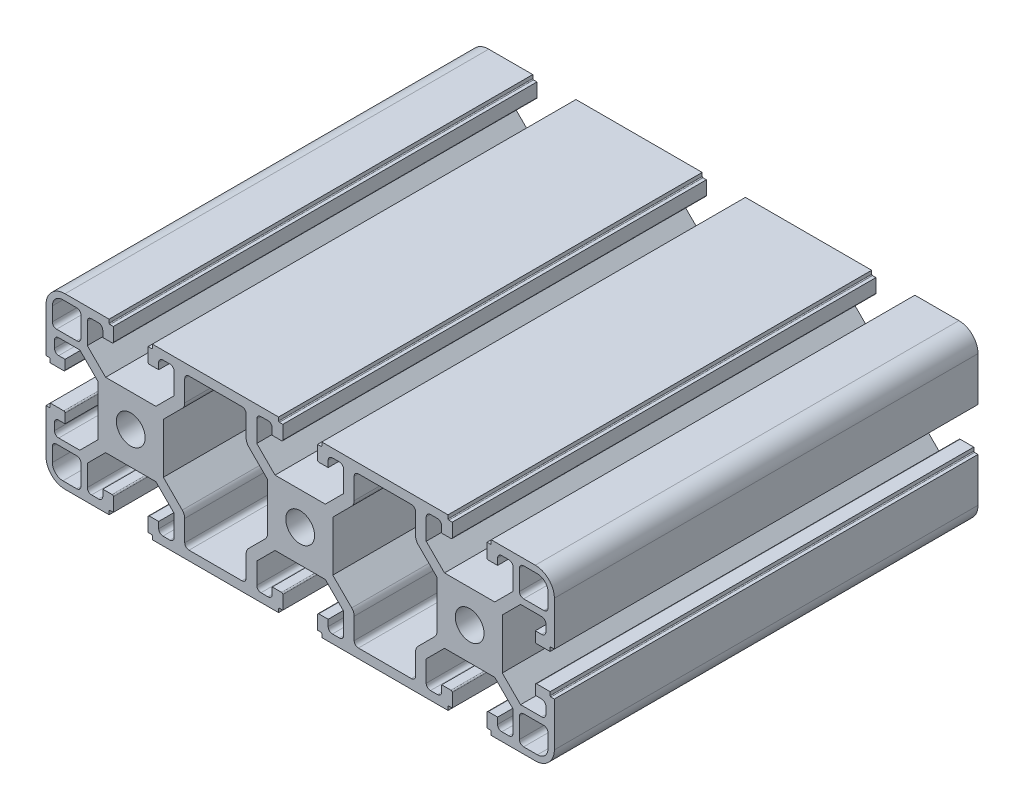
from build123d import *

# Parameters (mm, degrees)
SKETCH_1_R      = 3.4
EXTRUDE_1_DEPTH = 100


with BuildPart() as part:
    # 草图1 → 凸台-拉伸1 (new body)
    with BuildSketch(Plane.XY):
        with BuildLine():
            Line((-45.8856131, 20.757012623), (-56.2856131, 20.757012623))
            ThreePointArc((-56.2856131, 20.757012623), (-59.467593615, 19.438993138), (-60.7856131, 16.257012623))
            Line((-60.7856131, 16.257012623), (-60.7856131, 5.857012623))
            Line((-60.7856131, 5.857012623), (-59.9856131, 5.857012623))
            ThreePointArc((-59.9856131, 5.857012623), (-59.844191743, 5.798433979), (-59.7856131, 5.657012623))
            Line((-59.7856131, 5.657012623), (-59.7856131, 4.857012623))
            Line((-59.7856131, 4.857012623), (-56.5856131, 4.857012623))
            ThreePointArc((-56.5856131, 4.857012623), (-56.373481065, 4.944880588), (-56.2856131, 5.157012623))
            Line((-56.2856131, 5.157012623), (-56.2856131, 7.357012623))
            Line((-56.2856131, 7.357012623), (-57.7856131, 7.357012623))
            ThreePointArc((-57.7856131, 7.357012623), (-58.492719881, 7.649905842), (-58.7856131, 8.357012623))
            Line((-58.7856131, 8.357012623), (-58.7856131, 10.007012623))
            ThreePointArc((-58.7856131, 10.007012623), (-58.492719881, 10.714119404), (-57.7856131, 11.007012623))
            Line((-57.7856131, 11.007012623), (-52.803380053, 11.007012623))
            Line((-52.803380053, 11.007012623), (-48.4856131, 6.68924567))
            Line((-48.4856131, 6.68924567), (-48.4856131, -5.175220424))
            Line((-48.4856131, -5.175220424), (-52.803380053, -9.492987377))
            Line((-52.803380053, -9.492987377), (-57.7856131, -9.492987377))
            ThreePointArc((-57.7856131, -9.492987377), (-58.492719881, -9.200094158), (-58.7856131, -8.492987377))
            Line((-58.7856131, -8.492987377), (-58.7856131, -6.842987377))
            ThreePointArc((-58.7856131, -6.842987377), (-58.492719881, -6.135880596), (-57.7856131, -5.842987377))
            Line((-57.7856131, -5.842987377), (-56.2856131, -5.842987377))
            Line((-56.2856131, -5.842987377), (-56.2856131, -3.642987377))
            ThreePointArc((-56.2856131, -3.642987377), (-56.373481065, -3.430855343), (-56.5856131, -3.342987377))
            Line((-56.5856131, -3.342987377), (-59.7856131, -3.342987377))
            Line((-59.7856131, -3.342987377), (-59.7856131, -4.142987377))
            ThreePointArc((-59.7856131, -4.142987377), (-59.844191743, -4.284408734), (-59.9856131, -4.342987377))
            Line((-59.9856131, -4.342987377), (-60.7856131, -4.342987377))
            Line((-60.7856131, -4.342987377), (-60.7856131, -14.742987377))
            ThreePointArc((-60.7856131, -14.742987377), (-59.467593615, -17.924967893), (-56.2856131, -19.242987377))
            Line((-56.2856131, -19.242987377), (-45.8856131, -19.242987377))
            Line((-45.8856131, -19.242987377), (-45.8856131, -18.442987377))
            ThreePointArc((-45.8856131, -18.442987377), (-45.827034456, -18.301566021), (-45.6856131, -18.242987377))
            Line((-45.6856131, -18.242987377), (-44.8856131, -18.242987377))
            Line((-44.8856131, -18.242987377), (-44.8856131, -15.042987377))
            ThreePointArc((-44.8856131, -15.042987377), (-44.973481065, -14.830855343), (-45.1856131, -14.742987377))
            Line((-45.1856131, -14.742987377), (-47.3856131, -14.742987377))
            Line((-47.3856131, -14.742987377), (-47.3856131, -16.242987377))
            ThreePointArc((-47.3856131, -16.242987377), (-47.678506318, -16.950094158), (-48.3856131, -17.242987377))
            Line((-48.3856131, -17.242987377), (-50.0356131, -17.242987377))
            ThreePointArc((-50.0356131, -17.242987377), (-50.742719881, -16.950094158), (-51.0356131, -16.242987377))
            Line((-51.0356131, -16.242987377), (-51.0356131, -11.26075433))
            Line((-51.0356131, -11.26075433), (-46.717846147, -6.942987377))
            Line((-46.717846147, -6.942987377), (-34.853380053, -6.942987377))
            Line((-34.853380053, -6.942987377), (-30.5356131, -11.26075433))
            Line((-30.5356131, -11.26075433), (-30.5356131, -16.242987377))
            ThreePointArc((-30.5356131, -16.242987377), (-30.828506318, -16.950094158), (-31.5356131, -17.242987377))
            Line((-31.5356131, -17.242987377), (-33.1856131, -17.242987377))
            ThreePointArc((-33.1856131, -17.242987377), (-33.892719881, -16.950094158), (-34.1856131, -16.242987377))
            Line((-34.1856131, -16.242987377), (-34.1856131, -14.742987377))
            Line((-34.1856131, -14.742987377), (-36.3856131, -14.742987377))
            ThreePointArc((-36.3856131, -14.742987377), (-36.597745134, -14.830855343), (-36.6856131, -15.042987377))
            Line((-36.6856131, -15.042987377), (-36.6856131, -18.242987377))
            Line((-36.6856131, -18.242987377), (-35.8856131, -18.242987377))
            ThreePointArc((-35.8856131, -18.242987377), (-35.744191743, -18.301566021), (-35.6856131, -18.442987377))
            Line((-35.6856131, -18.442987377), (-35.6856131, -19.242987377))
            Line((-35.6856131, -19.242987377), (-25.2856131, -19.242987377))
            Line((-25.2856131, -19.242987377), (-16.2856131, -19.242987377))
            Line((-16.2856131, -19.242987377), (-5.8856131, -19.242987377))
            Line((-5.8856131, -19.242987377), (-5.8856131, -18.442987377))
            ThreePointArc((-5.8856131, -18.442987377), (-5.827034456, -18.301566021), (-5.6856131, -18.242987377))
            Line((-5.6856131, -18.242987377), (-4.8856131, -18.242987377))
            Line((-4.8856131, -18.242987377), (-4.8856131, -15.042987377))
            ThreePointArc((-4.8856131, -15.042987377), (-4.973481065, -14.830855343), (-5.1856131, -14.742987377))
            Line((-5.1856131, -14.742987377), (-7.3856131, -14.742987377))
            Line((-7.3856131, -14.742987377), (-7.3856131, -16.242987377))
            ThreePointArc((-7.3856131, -16.242987377), (-7.678506318, -16.950094158), (-8.3856131, -17.242987377))
            Line((-8.3856131, -17.242987377), (-10.0356131, -17.242987377))
            ThreePointArc((-10.0356131, -17.242987377), (-10.742719881, -16.950094158), (-11.0356131, -16.242987377))
            Line((-11.0356131, -16.242987377), (-11.0356131, -11.26075433))
            Line((-11.0356131, -11.26075433), (-6.717846147, -6.942987377))
            Line((-6.717846147, -6.942987377), (5.146619947, -6.942987377))
            Line((5.146619947, -6.942987377), (9.4643869, -11.26075433))
            Line((9.4643869, -11.26075433), (9.4643869, -16.242987377))
            ThreePointArc((9.4643869, -16.242987377), (9.171493682, -16.950094158), (8.4643869, -17.242987377))
            Line((8.4643869, -17.242987377), (6.8143869, -17.242987377))
            ThreePointArc((6.8143869, -17.242987377), (6.107280119, -16.950094158), (5.8143869, -16.242987377))
            Line((5.8143869, -16.242987377), (5.8143869, -14.742987377))
            Line((5.8143869, -14.742987377), (3.6143869, -14.742987377))
            ThreePointArc((3.6143869, -14.742987377), (3.402254866, -14.830855343), (3.3143869, -15.042987377))
            Line((3.3143869, -15.042987377), (3.3143869, -18.242987377))
            Line((3.3143869, -18.242987377), (4.1143869, -18.242987377))
            ThreePointArc((4.1143869, -18.242987377), (4.255808257, -18.301566021), (4.3143869, -18.442987377))
            Line((4.3143869, -18.442987377), (4.3143869, -19.242987377))
            Line((4.3143869, -19.242987377), (34.1143869, -19.242987377))
            Line((34.1143869, -19.242987377), (34.1143869, -18.442987377))
            ThreePointArc((34.1143869, -18.442987377), (34.172965544, -18.301566021), (34.3143869, -18.242987377))
            Line((34.3143869, -18.242987377), (35.1143869, -18.242987377))
            Line((35.1143869, -18.242987377), (35.1143869, -15.042987377))
            ThreePointArc((35.1143869, -15.042987377), (35.026518935, -14.830855343), (34.8143869, -14.742987377))
            Line((34.8143869, -14.742987377), (32.6143869, -14.742987377))
            Line((32.6143869, -14.742987377), (32.6143869, -16.242987377))
            ThreePointArc((32.6143869, -16.242987377), (32.321493682, -16.950094158), (31.6143869, -17.242987377))
            Line((31.6143869, -17.242987377), (29.9643869, -17.242987377))
            ThreePointArc((29.9643869, -17.242987377), (29.257280119, -16.950094158), (28.9643869, -16.242987377))
            Line((28.9643869, -16.242987377), (28.9643869, -11.26075433))
            Line((28.9643869, -11.26075433), (33.282153853, -6.942987377))
            Line((33.282153853, -6.942987377), (45.146619947, -6.942987377))
            Line((45.146619947, -6.942987377), (49.4643869, -11.26075433))
            Line((49.4643869, -11.26075433), (49.4643869, -16.242987377))
            ThreePointArc((49.4643869, -16.242987377), (49.171493682, -16.950094158), (48.4643869, -17.242987377))
            Line((48.4643869, -17.242987377), (46.8143869, -17.242987377))
            ThreePointArc((46.8143869, -17.242987377), (46.107280119, -16.950094158), (45.8143869, -16.242987377))
            Line((45.8143869, -16.242987377), (45.8143869, -14.742987377))
            Line((45.8143869, -14.742987377), (43.6143869, -14.742987377))
            ThreePointArc((43.6143869, -14.742987377), (43.402254866, -14.830855343), (43.3143869, -15.042987377))
            Line((43.3143869, -15.042987377), (43.3143869, -18.242987377))
            Line((43.3143869, -18.242987377), (44.1143869, -18.242987377))
            ThreePointArc((44.1143869, -18.242987377), (44.255808257, -18.301566021), (44.3143869, -18.442987377))
            Line((44.3143869, -18.442987377), (44.3143869, -19.242987377))
            Line((44.3143869, -19.242987377), (54.7143869, -19.242987377))
            ThreePointArc((54.7143869, -19.242987377), (57.896367416, -17.924967893), (59.2143869, -14.742987377))
            Line((59.2143869, -14.742987377), (59.2143869, -4.342987377))
            Line((59.2143869, -4.342987377), (58.4143869, -4.342987377))
            ThreePointArc((58.4143869, -4.342987377), (58.272965544, -4.284408734), (58.2143869, -4.142987377))
            Line((58.2143869, -4.142987377), (58.2143869, -3.342987377))
            Line((58.2143869, -3.342987377), (55.0143869, -3.342987377))
            ThreePointArc((55.0143869, -3.342987377), (54.802254866, -3.430855343), (54.7143869, -3.642987377))
            Line((54.7143869, -3.642987377), (54.7143869, -5.842987377))
            Line((54.7143869, -5.842987377), (56.2143869, -5.842987377))
            ThreePointArc((56.2143869, -5.842987377), (56.921493682, -6.135880596), (57.2143869, -6.842987377))
            Line((57.2143869, -6.842987377), (57.2143869, -8.492987377))
            ThreePointArc((57.2143869, -8.492987377), (56.921493682, -9.200094158), (56.2143869, -9.492987377))
            Line((56.2143869, -9.492987377), (51.232153853, -9.492987377))
            Line((51.232153853, -9.492987377), (46.9143869, -5.175220424))
            Line((46.9143869, -5.175220424), (46.9143869, 6.68924567))
            Line((46.9143869, 6.68924567), (51.232153853, 11.007012623))
            Line((51.232153853, 11.007012623), (56.2143869, 11.007012623))
            ThreePointArc((56.2143869, 11.007012623), (56.921493682, 10.714119404), (57.2143869, 10.007012623))
            Line((57.2143869, 10.007012623), (57.2143869, 8.357012623))
            ThreePointArc((57.2143869, 8.357012623), (56.921493682, 7.649905842), (56.2143869, 7.357012623))
            Line((56.2143869, 7.357012623), (54.7143869, 7.357012623))
            Line((54.7143869, 7.357012623), (54.7143869, 5.157012623))
            ThreePointArc((54.7143869, 5.157012623), (54.802254866, 4.944880588), (55.0143869, 4.857012623))
            Line((55.0143869, 4.857012623), (58.2143869, 4.857012623))
            Line((58.2143869, 4.857012623), (58.2143869, 5.657012623))
            ThreePointArc((58.2143869, 5.657012623), (58.272965544, 5.798433979), (58.4143869, 5.857012623))
            Line((58.4143869, 5.857012623), (59.2143869, 5.857012623))
            Line((59.2143869, 5.857012623), (59.2143869, 16.257012623))
            ThreePointArc((59.2143869, 16.257012623), (57.896367416, 19.438993138), (54.7143869, 20.757012623))
            Line((54.7143869, 20.757012623), (44.3143869, 20.757012623))
            Line((44.3143869, 20.757012623), (44.3143869, 19.957012623))
            ThreePointArc((44.3143869, 19.957012623), (44.255808257, 19.815591266), (44.1143869, 19.757012623))
            Line((44.1143869, 19.757012623), (43.3143869, 19.757012623))
            Line((43.3143869, 19.757012623), (43.3143869, 16.557012623))
            ThreePointArc((43.3143869, 16.557012623), (43.402254866, 16.344880588), (43.6143869, 16.257012623))
            Line((43.6143869, 16.257012623), (45.8143869, 16.257012623))
            Line((45.8143869, 16.257012623), (45.8143869, 17.757012623))
            ThreePointArc((45.8143869, 17.757012623), (46.107280119, 18.464119404), (46.8143869, 18.757012623))
            Line((46.8143869, 18.757012623), (48.4643869, 18.757012623))
            ThreePointArc((48.4643869, 18.757012623), (49.171493682, 18.464119404), (49.4643869, 17.757012623))
            Line((49.4643869, 17.757012623), (49.4643869, 12.774779576))
            Line((49.4643869, 12.774779576), (45.146619947, 8.457012623))
            Line((45.146619947, 8.457012623), (33.282153853, 8.457012623))
            Line((33.282153853, 8.457012623), (28.9643869, 12.774779576))
            Line((28.9643869, 12.774779576), (28.9643869, 17.757012623))
            ThreePointArc((28.9643869, 17.757012623), (29.257280119, 18.464119404), (29.9643869, 18.757012623))
            Line((29.9643869, 18.757012623), (31.6143869, 18.757012623))
            ThreePointArc((31.6143869, 18.757012623), (32.321493682, 18.464119404), (32.6143869, 17.757012623))
            Line((32.6143869, 17.757012623), (32.6143869, 16.257012623))
            Line((32.6143869, 16.257012623), (34.8143869, 16.257012623))
            ThreePointArc((34.8143869, 16.257012623), (35.026518935, 16.344880588), (35.1143869, 16.557012623))
            Line((35.1143869, 16.557012623), (35.1143869, 19.757012623))
            Line((35.1143869, 19.757012623), (34.3143869, 19.757012623))
            ThreePointArc((34.3143869, 19.757012623), (34.172965544, 19.815591266), (34.1143869, 19.957012623))
            Line((34.1143869, 19.957012623), (34.1143869, 20.757012623))
            Line((34.1143869, 20.757012623), (4.3143869, 20.757012623))
            Line((4.3143869, 20.757012623), (4.3143869, 19.957012623))
            ThreePointArc((4.3143869, 19.957012623), (4.255808257, 19.815591266), (4.1143869, 19.757012623))
            Line((4.1143869, 19.757012623), (3.3143869, 19.757012623))
            Line((3.3143869, 19.757012623), (3.3143869, 16.557012623))
            ThreePointArc((3.3143869, 16.557012623), (3.402254866, 16.344880588), (3.6143869, 16.257012623))
            Line((3.6143869, 16.257012623), (5.8143869, 16.257012623))
            Line((5.8143869, 16.257012623), (5.8143869, 17.757012623))
            ThreePointArc((5.8143869, 17.757012623), (6.107280119, 18.464119404), (6.8143869, 18.757012623))
            Line((6.8143869, 18.757012623), (8.4643869, 18.757012623))
            ThreePointArc((8.4643869, 18.757012623), (9.171493682, 18.464119404), (9.4643869, 17.757012623))
            Line((9.4643869, 17.757012623), (9.4643869, 12.774779576))
            Line((9.4643869, 12.774779576), (5.146619947, 8.457012623))
            Line((5.146619947, 8.457012623), (-6.717846147, 8.457012623))
            Line((-6.717846147, 8.457012623), (-11.0356131, 12.774779576))
            Line((-11.0356131, 12.774779576), (-11.0356131, 17.757012623))
            ThreePointArc((-11.0356131, 17.757012623), (-10.742719881, 18.464119404), (-10.0356131, 18.757012623))
            Line((-10.0356131, 18.757012623), (-8.3856131, 18.757012623))
            ThreePointArc((-8.3856131, 18.757012623), (-7.678506318, 18.464119404), (-7.3856131, 17.757012623))
            Line((-7.3856131, 17.757012623), (-7.3856131, 16.257012623))
            Line((-7.3856131, 16.257012623), (-5.1856131, 16.257012623))
            ThreePointArc((-5.1856131, 16.257012623), (-4.973481065, 16.344880588), (-4.8856131, 16.557012623))
            Line((-4.8856131, 16.557012623), (-4.8856131, 19.757012623))
            Line((-4.8856131, 19.757012623), (-5.6856131, 19.757012623))
            ThreePointArc((-5.6856131, 19.757012623), (-5.827034456, 19.815591266), (-5.8856131, 19.957012623))
            Line((-5.8856131, 19.957012623), (-5.8856131, 20.757012623))
            Line((-5.8856131, 20.757012623), (-16.2856131, 20.757012623))
            Line((-16.2856131, 20.757012623), (-25.2856131, 20.757012623))
            Line((-25.2856131, 20.757012623), (-35.6856131, 20.757012623))
            Line((-35.6856131, 20.757012623), (-35.6856131, 19.957012623))
            ThreePointArc((-35.6856131, 19.957012623), (-35.744191743, 19.815591266), (-35.8856131, 19.757012623))
            Line((-35.8856131, 19.757012623), (-36.6856131, 19.757012623))
            Line((-36.6856131, 19.757012623), (-36.6856131, 16.557012623))
            ThreePointArc((-36.6856131, 16.557012623), (-36.597745134, 16.344880588), (-36.3856131, 16.257012623))
            Line((-36.3856131, 16.257012623), (-34.1856131, 16.257012623))
            Line((-34.1856131, 16.257012623), (-34.1856131, 17.757012623))
            ThreePointArc((-34.1856131, 17.757012623), (-33.892719881, 18.464119404), (-33.1856131, 18.757012623))
            Line((-33.1856131, 18.757012623), (-31.5356131, 18.757012623))
            ThreePointArc((-31.5356131, 18.757012623), (-30.828506318, 18.464119404), (-30.5356131, 17.757012623))
            Line((-30.5356131, 17.757012623), (-30.5356131, 12.774779576))
            Line((-30.5356131, 12.774779576), (-34.853380053, 8.457012623))
            Line((-34.853380053, 8.457012623), (-46.717846147, 8.457012623))
            Line((-46.717846147, 8.457012623), (-51.0356131, 12.774779576))
            Line((-51.0356131, 12.774779576), (-51.0356131, 17.757012623))
            ThreePointArc((-51.0356131, 17.757012623), (-50.742719881, 18.464119404), (-50.0356131, 18.757012623))
            Line((-50.0356131, 18.757012623), (-48.3856131, 18.757012623))
            ThreePointArc((-48.3856131, 18.757012623), (-47.678506318, 18.464119404), (-47.3856131, 17.757012623))
            Line((-47.3856131, 17.757012623), (-47.3856131, 16.257012623))
            Line((-47.3856131, 16.257012623), (-45.1856131, 16.257012623))
            ThreePointArc((-45.1856131, 16.257012623), (-44.973481065, 16.344880588), (-44.8856131, 16.557012623))
            Line((-44.8856131, 16.557012623), (-44.8856131, 19.757012623))
            Line((-44.8856131, 19.757012623), (-45.6856131, 19.757012623))
            ThreePointArc((-45.6856131, 19.757012623), (-45.827034456, 19.815591266), (-45.8856131, 19.957012623))
            Line((-45.8856131, 19.957012623), (-45.8856131, 20.757012623))
        make_face()
        with Locations((-40.7856131, 0.757012623)):
            Circle(SKETCH_1_R, mode=Mode.SUBTRACT)
        with Locations((-0.7856131, 0.757012623)):
            Circle(SKETCH_1_R, mode=Mode.SUBTRACT)
        with Locations((39.2143869, 0.757012623)):
            Circle(SKETCH_1_R, mode=Mode.SUBTRACT)
        with BuildLine():
            Line((-59.2896131, 16.761012623), (-59.2896131, 13.507012623))
            ThreePointArc((-59.2896131, 13.507012623), (-58.996719881, 12.799905842), (-58.2896131, 12.507012623))
            Line((-58.2896131, 12.507012623), (-53.5356131, 12.507012623))
            ThreePointArc((-53.5356131, 12.507012623), (-52.828506318, 12.799905842), (-52.5356131, 13.507012623))
            Line((-52.5356131, 13.507012623), (-52.5356131, 18.261012623))
            ThreePointArc((-52.5356131, 18.261012623), (-52.828506318, 18.968119404), (-53.5356131, 19.261012623))
            Line((-53.5356131, 19.261012623), (-56.7896131, 19.261012623))
            ThreePointArc((-56.7896131, 19.261012623), (-58.557380053, 18.528779576), (-59.2896131, 16.761012623))
        make_face(mode=Mode.SUBTRACT)
        with BuildLine():
            Line((-33.0856131, -5.175220424), (-33.0856131, 6.68924567))
            Line((-33.0856131, 6.68924567), (-28.621399537, 11.153459232))
            ThreePointArc((-28.621399537, 11.153459232), (-28.187854035, 11.80230593), (-28.0356131, 12.567672795))
            Line((-28.0356131, 12.567672795), (-28.0356131, 17.557012623))
            ThreePointArc((-28.0356131, 17.557012623), (-27.742719881, 18.264119404), (-27.0356131, 18.557012623))
            Line((-27.0356131, 18.557012623), (-14.5356131, 18.557012623))
            ThreePointArc((-14.5356131, 18.557012623), (-13.828506318, 18.264119404), (-13.5356131, 17.557012623))
            Line((-13.5356131, 17.557012623), (-13.5356131, 12.567672795))
            ThreePointArc((-13.5356131, 12.567672795), (-13.383372165, 11.80230593), (-12.949826662, 11.153459232))
            Line((-12.949826662, 11.153459232), (-8.4856131, 6.68924567))
            Line((-8.4856131, 6.68924567), (-8.4856131, -4.3467933))
            ThreePointArc((-8.4856131, -4.3467933), (-8.637854035, -5.112160164), (-9.071399537, -5.761006862))
            Line((-9.071399537, -5.761006862), (-12.949826662, -9.639433987))
            ThreePointArc((-12.949826662, -9.639433987), (-13.383372165, -10.288280684), (-13.5356131, -11.053647549))
            Line((-13.5356131, -11.053647549), (-13.5356131, -16.042987377))
            ThreePointArc((-13.5356131, -16.042987377), (-13.828506318, -16.750094158), (-14.5356131, -17.042987377))
            Line((-14.5356131, -17.042987377), (-27.0356131, -17.042987377))
            ThreePointArc((-27.0356131, -17.042987377), (-27.742719881, -16.750094158), (-28.0356131, -16.042987377))
            Line((-28.0356131, -16.042987377), (-28.0356131, -11.053647549))
            ThreePointArc((-28.0356131, -11.053647549), (-28.187854035, -10.288280684), (-28.621399537, -9.639433987))
            Line((-28.621399537, -9.639433987), (-33.0856131, -5.175220424))
        make_face(mode=Mode.SUBTRACT)
        with BuildLine():
            Line((-59.2896131, -15.246987377), (-59.2896131, -11.992987377))
            ThreePointArc((-59.2896131, -11.992987377), (-58.996719881, -11.285880596), (-58.2896131, -10.992987377))
            Line((-58.2896131, -10.992987377), (-53.5356131, -10.992987377))
            ThreePointArc((-53.5356131, -10.992987377), (-52.828506318, -11.285880596), (-52.5356131, -11.992987377))
            Line((-52.5356131, -11.992987377), (-52.5356131, -16.746987377))
            ThreePointArc((-52.5356131, -16.746987377), (-52.828506318, -17.454094158), (-53.5356131, -17.746987377))
            Line((-53.5356131, -17.746987377), (-56.7896131, -17.746987377))
            ThreePointArc((-56.7896131, -17.746987377), (-58.557380053, -17.01475433), (-59.2896131, -15.246987377))
        make_face(mode=Mode.SUBTRACT)
        with BuildLine():
            Line((6.9143869, -5.175220424), (6.9143869, 6.68924567))
            Line((6.9143869, 6.68924567), (11.378600463, 11.153459232))
            ThreePointArc((11.378600463, 11.153459232), (11.812145965, 11.80230593), (11.9643869, 12.567672795))
            Line((11.9643869, 12.567672795), (11.9643869, 17.557012623))
            ThreePointArc((11.9643869, 17.557012623), (12.257280119, 18.264119404), (12.9643869, 18.557012623))
            Line((12.9643869, 18.557012623), (25.4643869, 18.557012623))
            ThreePointArc((25.4643869, 18.557012623), (26.171493682, 18.264119404), (26.4643869, 17.557012623))
            Line((26.4643869, 17.557012623), (26.4643869, 12.567672795))
            ThreePointArc((26.4643869, 12.567672795), (26.616627835, 11.80230593), (27.050173338, 11.153459232))
            Line((27.050173338, 11.153459232), (31.5143869, 6.68924567))
            Line((31.5143869, 6.68924567), (31.5143869, -4.3467933))
            ThreePointArc((31.5143869, -4.3467933), (31.362145965, -5.112160164), (30.928600463, -5.761006862))
            Line((30.928600463, -5.761006862), (27.050173338, -9.639433987))
            ThreePointArc((27.050173338, -9.639433987), (26.616627835, -10.288280684), (26.4643869, -11.053647549))
            Line((26.4643869, -11.053647549), (26.4643869, -16.042987377))
            ThreePointArc((26.4643869, -16.042987377), (26.171493682, -16.750094158), (25.4643869, -17.042987377))
            Line((25.4643869, -17.042987377), (12.9643869, -17.042987377))
            ThreePointArc((12.9643869, -17.042987377), (12.257280119, -16.750094158), (11.9643869, -16.042987377))
            Line((11.9643869, -16.042987377), (11.9643869, -11.053647549))
            ThreePointArc((11.9643869, -11.053647549), (11.812145965, -10.288280684), (11.378600463, -9.639433987))
            Line((11.378600463, -9.639433987), (6.9143869, -5.175220424))
        make_face(mode=Mode.SUBTRACT)
        with BuildLine():
            Line((57.7183869, 16.761012623), (57.7183869, 13.507012623))
            ThreePointArc((57.7183869, 13.507012623), (57.425493682, 12.799905842), (56.7183869, 12.507012623))
            Line((56.7183869, 12.507012623), (51.9643869, 12.507012623))
            ThreePointArc((51.9643869, 12.507012623), (51.257280119, 12.799905842), (50.9643869, 13.507012623))
            Line((50.9643869, 13.507012623), (50.9643869, 18.261012623))
            ThreePointArc((50.9643869, 18.261012623), (51.257280119, 18.968119404), (51.9643869, 19.261012623))
            Line((51.9643869, 19.261012623), (55.2183869, 19.261012623))
            ThreePointArc((55.2183869, 19.261012623), (56.986153853, 18.528779576), (57.7183869, 16.761012623))
        make_face(mode=Mode.SUBTRACT)
        with BuildLine():
            Line((57.7183869, -15.246987377), (57.7183869, -11.992987377))
            ThreePointArc((57.7183869, -11.992987377), (57.425493682, -11.285880596), (56.7183869, -10.992987377))
            Line((56.7183869, -10.992987377), (51.9643869, -10.992987377))
            ThreePointArc((51.9643869, -10.992987377), (51.257280119, -11.285880596), (50.9643869, -11.992987377))
            Line((50.9643869, -11.992987377), (50.9643869, -16.746987377))
            ThreePointArc((50.9643869, -16.746987377), (51.257280119, -17.454094158), (51.9643869, -17.746987377))
            Line((51.9643869, -17.746987377), (55.2183869, -17.746987377))
            ThreePointArc((55.2183869, -17.746987377), (56.986153853, -17.01475433), (57.7183869, -15.246987377))
        make_face(mode=Mode.SUBTRACT)
    extrude(amount=EXTRUDE_1_DEPTH)


solid = part.part
